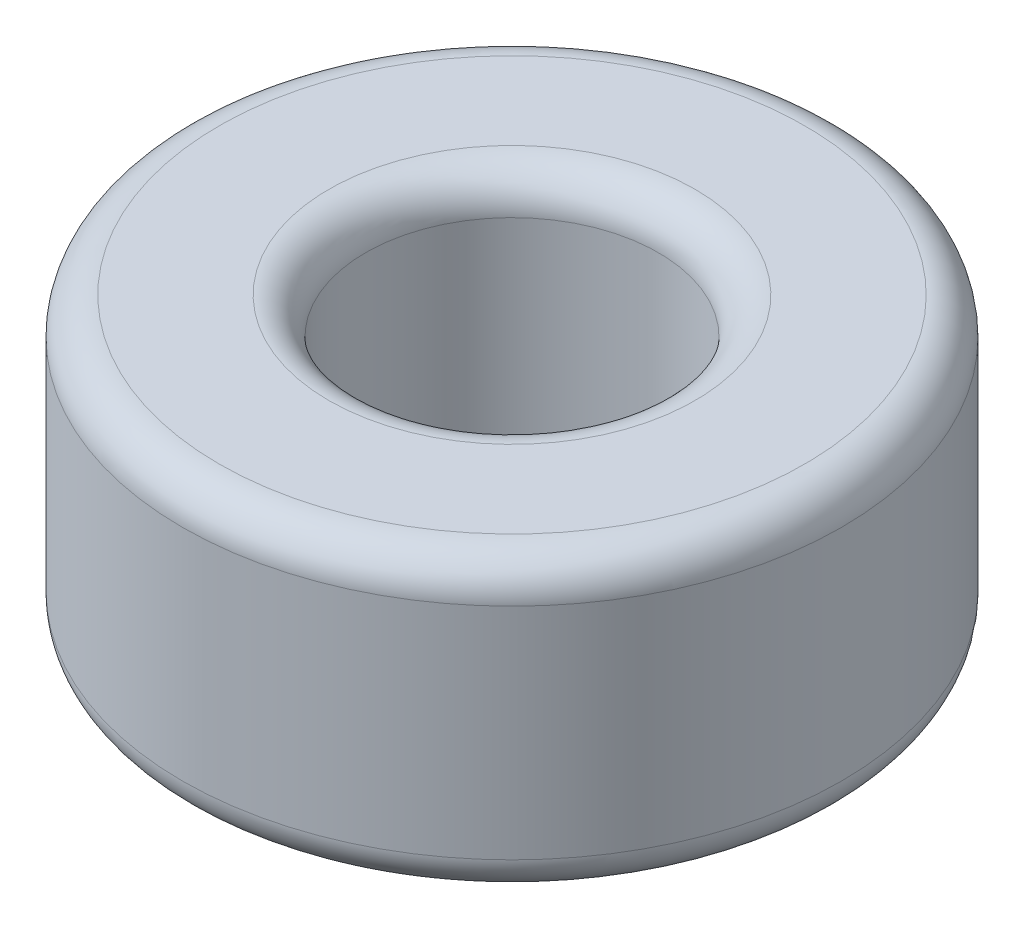
from build123d import *

# Parameters (mm, degrees)
SKETCH_1_R      = 4.5
SKETCH_1_R_2    = 2
EXTRUDE_1_DEPTH = 4
FILLET_1_R      = 0.5


with BuildPart() as part:
    # 草圖1 → 填料-伸長1 (new body)
    with BuildSketch(Plane(origin=(0, 0, 0), x_dir=(1, 0, 0), z_dir=(0, 1, 0))):
        with Locations(Location((0, 0, 0), (0, 0, 270))):
            Circle(SKETCH_1_R)
        with Locations(Location((0, 0, 0), (0, 0, 270))):
            Circle(SKETCH_1_R_2, mode=Mode.SUBTRACT)
    extrude(amount=EXTRUDE_1_DEPTH)

    # 圓角1
    fillet_1_edges = [part.edges().sort_by_distance(p)[0] for p in [
        (0, 0, -4.5),
        (0, 4, -4.5),
        (0, 0, -2),
        (0, 4, -2),
    ]]
    fillet(fillet_1_edges, radius=FILLET_1_R)


solid = part.part
